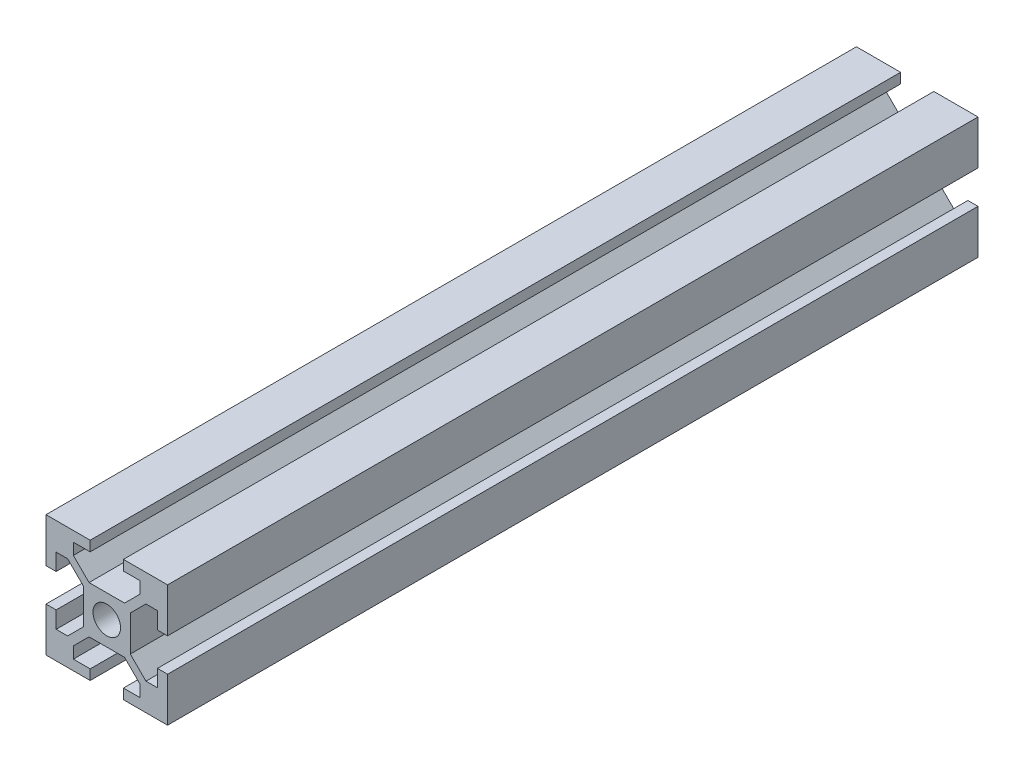
from build123d import *

# Parameters (mm, degrees)
SKETCH_1_R      = 3.4
EXTRUDE_1_DEPTH = 200


with BuildPart() as part:
    # 草图1 → 凸台-拉伸1 (new body)
    with BuildSketch(Plane.XY):
        Polygon((-4.1, 12.5), (-4.1, 15), (-8.25, 15), (-15, 15), (-15, 8.25), (-15, 4.1), (-12.5, 4.1), (-12.5, 8.25), (-9.664213562, 8.25), (-5.8, 4.385786438), (-5.8, -4.385786438), (-9.664213562, -8.25), (-12.5, -8.25), (-12.5, -4.1), (-15, -4.1), (-15, -8.25), (-15, -15), (-8.25, -15), (-4.1, -15), (-4.1, -12.5), (-8.25, -12.5), (-8.25, -9.664213562), (-4.385786438, -5.8), (4.385786438, -5.8), (8.25, -9.664213562), (8.25, -12.5), (4.1, -12.5), (4.1, -15), (8.25, -15), (15, -15), (15, -8.25), (15, -4.1), (12.5, -4.1), (12.5, -8.25), (9.664213562, -8.25), (5.8, -4.385786438), (5.8, 4.385786438), (9.664213562, 8.25), (12.5, 8.25), (12.5, 4.1), (15, 4.1), (15, 8.25), (15, 15), (8.25, 15), (4.1, 15), (4.1, 12.5), (8.25, 12.5), (8.25, 9.664213562), (4.385786438, 5.8), (-4.385786438, 5.8), (-8.25, 9.664213562), (-8.25, 12.5), align=None)
        Circle(SKETCH_1_R, mode=Mode.SUBTRACT)
    extrude(amount=EXTRUDE_1_DEPTH)


solid = part.part
